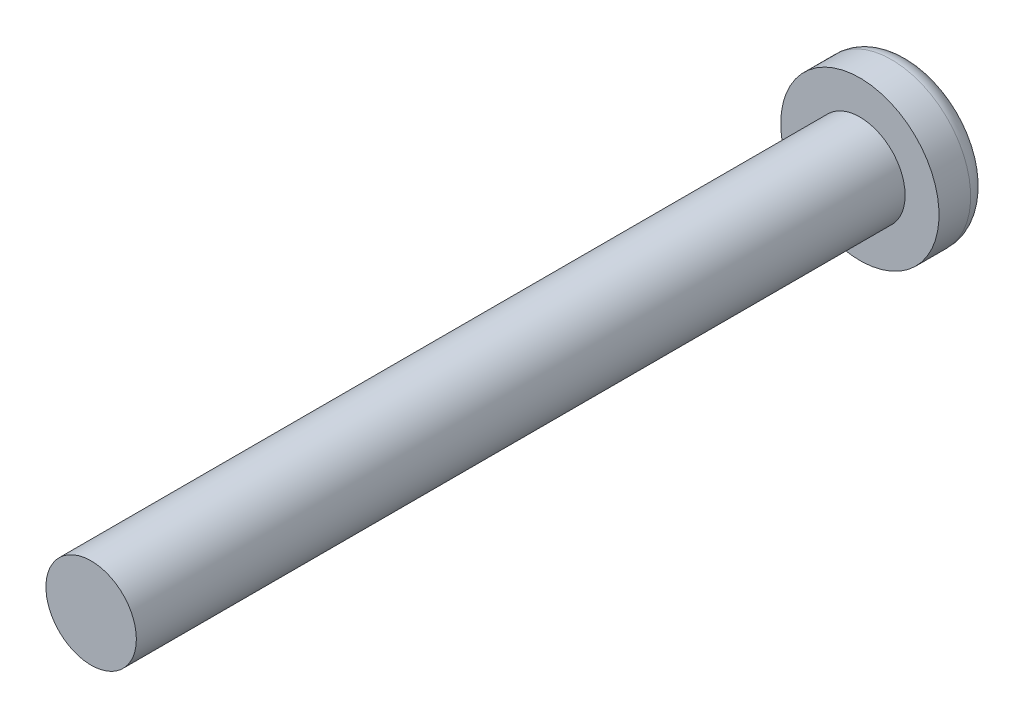
from build123d import *

# Parameters (mm, degrees)
SKETCH_1_R      = 5
EXTRUDE_1_DEPTH = 85
SKETCH_2_R      = 8.75
EXTRUDE_2_DEPTH = 5.5
FILLET_2_R      = 2


with BuildPart() as part:
    # Sketch 1 → 凸台-拉伸1 (new body)
    with BuildSketch(Plane.XY):
        Circle(SKETCH_1_R)
    extrude(amount=EXTRUDE_1_DEPTH)

    # 草图2 → 凸台-拉伸2 (add)
    with BuildSketch(Plane(origin=(0, 0, 0), x_dir=(-1, 0, 0), z_dir=(0, 0, -1))):
        Circle(SKETCH_2_R)
    extrude(amount=EXTRUDE_2_DEPTH)

    # 圆角2
    fillet_2_edges = [part.edges().sort_by_distance(p)[0] for p in [
        (8.75, 0, -5.5),
    ]]
    fillet(fillet_2_edges, radius=FILLET_2_R)


solid = part.part
